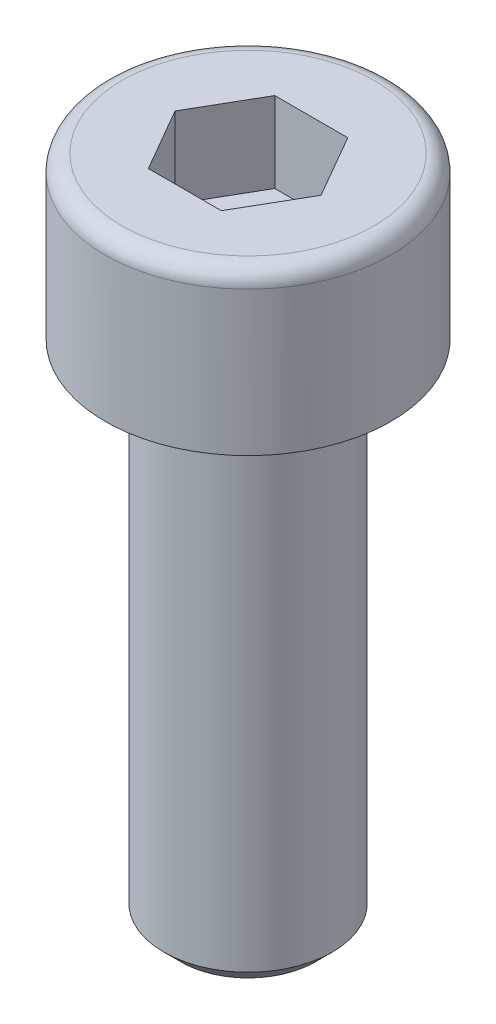
from build123d import *

# Parameters (mm, degrees)
CHAMFER1_SIZE      = 0.4
FILLET1_R          = 0.4
CUT_EXTRUDE1_DEPTH = 1.91


with BuildPart() as part:
    # Sketch1 → Revolve1 (revolve)
    with BuildSketch(Plane.XY, mode=Mode.PRIVATE) as revolve1_sk:
        Polygon((0, 0), (0, 3.82), (3.39, 3.82), (3.39, 0), (2, 0), (2, -12), (0, -12), align=None)
    revolve(revolve1_sk.sketch.rotate(Axis((0, 3.82, 0), (0, 1, 0)), 90), axis=Axis((0, 3.82, 0), (0, 1, 0)))

    # Chamfer1
    chamfer1_edges = [part.edges().sort_by_distance(p)[0] for p in [
        (0, -12, 2),
    ]]
    chamfer(chamfer1_edges, length=CHAMFER1_SIZE)

    # Fillet1
    fillet1_edges = [part.edges().sort_by_distance(p)[0] for p in [
        (0, 3.82, 3.39),
    ]]
    fillet(fillet1_edges, radius=FILLET1_R)

    # Sketch2 → Cut-Extrude1 (cut)
    with BuildSketch(Plane(origin=(0, 3.82, 0), x_dir=(1, 0, 0), z_dir=(0, 1, 0))):
        Polygon((0.866025404, -1.5), (1.732050808, 0), (0.866025404, 1.5), (-0.866025404, 1.5), (-1.732050808, 0), (-0.866025404, -1.5), align=None)
    extrude(amount=-CUT_EXTRUDE1_DEPTH, mode=Mode.SUBTRACT)


solid = part.part
